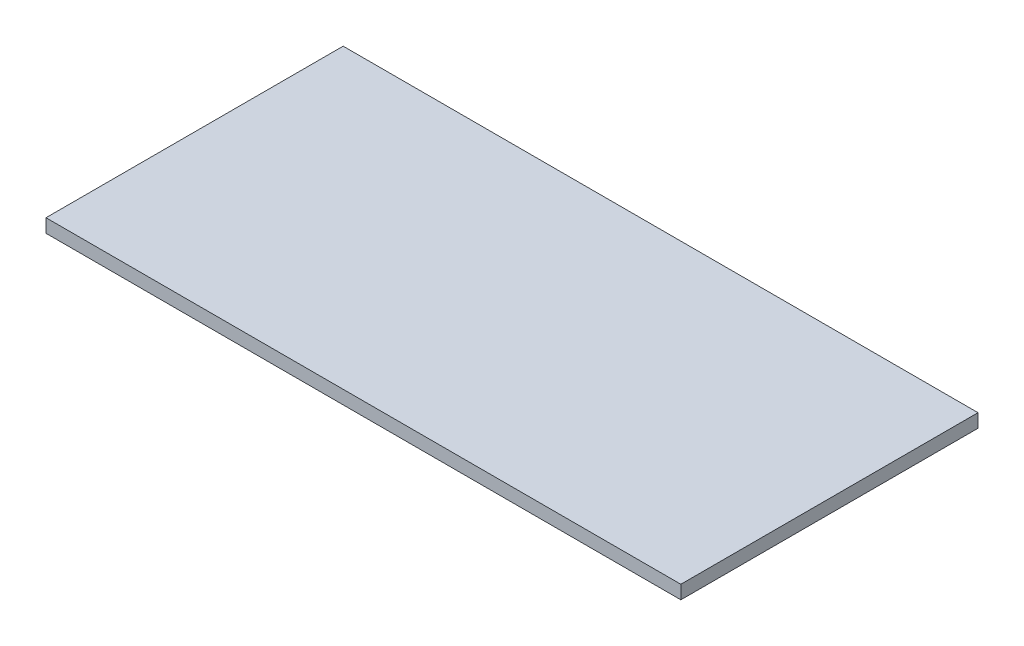
from build123d import *

# Parameters (mm, degrees)
SKETCH1_W           = 141
SKETCH1_H           = 66
BOSS_EXTRUDE1_DEPTH = 3


with BuildPart() as part:
    # Sketch1 → Boss-Extrude1 (new body)
    with BuildSketch(Plane(origin=(0, 0, 0), x_dir=(1, 0, 0), z_dir=(0, 1, 0))):
        Rectangle(SKETCH1_W, SKETCH1_H)
    extrude(amount=BOSS_EXTRUDE1_DEPTH)


solid = part.part
